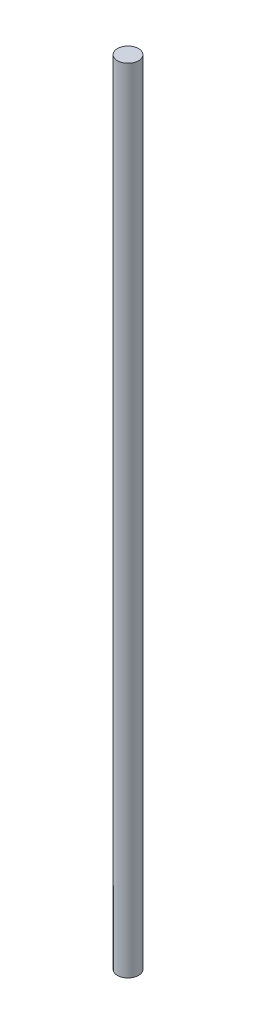
from build123d import *

# Parameters (mm, degrees)
CROQUIS1_R              = 1.6
SALIENTE_EXTRUIR1_DEPTH = 120


with BuildPart() as part:
    # Croquis1 → Saliente-Extruir1 (new body)
    with BuildSketch(Plane(origin=(0, 0, 0), x_dir=(1, 0, 0), z_dir=(0, 1, 0))):
        with Locations(Location((0, 0, 0), (0, 0, 270))):
            Circle(CROQUIS1_R)
    extrude(amount=SALIENTE_EXTRUIR1_DEPTH)


solid = part.part
